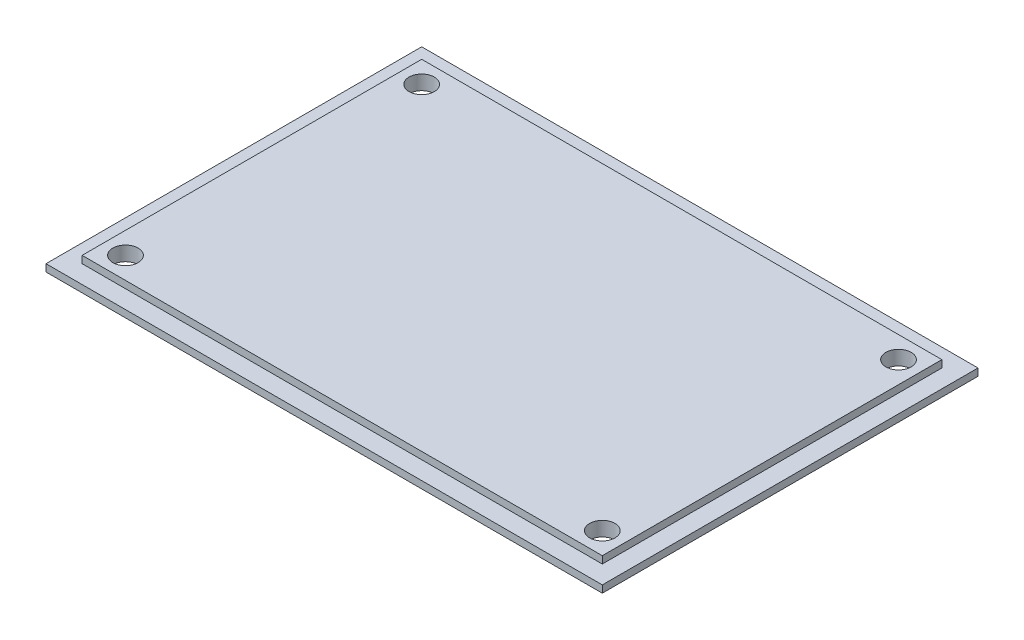
from build123d import *

# Parameters (mm, degrees)
SKETCH1_W           = 77
SKETCH1_H           = 52
BOSS_EXTRUDE1_DEPTH = 1
SKETCH2_W           = 72
SKETCH2_H           = 47
BOSS_EXTRUDE2_DEPTH = 1
SKETCH3_R           = 1.75
CUT_EXTRUDE1_DEPTH  = 11
CUT_EXTRUDE2_DEPTH  = 0.4


with BuildPart() as part:
    # Sketch1 → Boss-Extrude1 (new body)
    with BuildSketch(Plane(origin=(0, 0, 0), x_dir=(1, 0, 0), z_dir=(0, 1, 0))):
        Rectangle(SKETCH1_W, SKETCH1_H)
    extrude(amount=BOSS_EXTRUDE1_DEPTH)

    # Sketch2 → Boss-Extrude2 (add)
    with BuildSketch(Plane(origin=(0, 1, 0), x_dir=(1, 0, 0), z_dir=(0, 1, 0))):
        Rectangle(SKETCH2_W, SKETCH2_H)
    extrude(amount=BOSS_EXTRUDE2_DEPTH)

    # Sketch3 → Cut-Extrude1 (cut)
    with BuildSketch(Plane(origin=(0, 2, 0), x_dir=(1, 0, 0), z_dir=(0, 1, 0))):
        with Locations(Location((-33, 20.5, 0), (0, 0, 270))):
            Circle(SKETCH3_R)
        with Locations(Location((33, 20.5, 0), (0, 0, 270))):
            Circle(SKETCH3_R)
        with Locations(Location((33, -20.5, 0), (0, 0, 270))):
            Circle(SKETCH3_R)
        with Locations(Location((-33, -20.5, 0), (0, 0, 270))):
            Circle(SKETCH3_R)
    extrude(amount=-CUT_EXTRUDE1_DEPTH, mode=Mode.SUBTRACT)

    # Sketch4 → Cut-Extrude2 (cut)
    # profile 1 of 10: a face of its own
    with BuildSketch(Plane.XZ):
        with BuildLine():
            Line((-20.761007933, 11.297990355), (-21.613271555, 10.518232743))
            add(Edge.make_bspline(
                [(-21.613271555, 10.518232743), (-21.649778874, 10.569730112), (-21.719867836, 10.668597879), (-21.833474732, 10.800984149), (-21.946568635, 10.91391949), (-22.060197291, 11.006932109), (-22.17536786, 11.079456886), (-22.291880425, 11.130805229), (-22.409074442, 11.163447858), (-22.487810731, 11.167512651), (-22.526592869, 11.169514794)],
                knots=[0, 0, 0, 0, 1.299362458, 2.494594718, 3.587462134, 4.587049575, 5.512617175, 6.380583204, 7.202344345, 8, 8, 8, 8], degree=3))
            add(Edge.make_bspline(
                [(-22.526592869, 11.169514794), (-22.562767735, 11.168246144), (-22.632611897, 11.165796714), (-22.732179932, 11.141449565), (-22.820577852, 11.099429959), (-22.897719383, 11.044485791), (-22.958826857, 10.978290805), (-23.007616436, 10.908869286), (-23.035089069, 10.832243628), (-23.038705008, 10.779614036), (-23.040495113, 10.753559265)],
                knots=[0, 0, 0, 0, 1.185010067, 2.2879431, 3.333075148, 4.379039566, 5.372662701, 6.27520591, 7.14612461, 8, 8, 8, 8], degree=3))
            add(Edge.make_bspline(
                [(-23.040495113, 10.753559265), (-23.039373345, 10.727128774), (-23.037114261, 10.673901436), (-23.015294583, 10.595890145), (-22.982406099, 10.519664032), (-22.95097981, 10.473261569), (-22.934916186, 10.449542839)],
                knots=[0, 0, 0, 0, 0.967525499, 1.948461899, 2.951351359, 4, 4, 4, 4], degree=3))
            add(Edge.make_bspline(
                [(-22.934916186, 10.449542839), (-22.920312615, 10.431106518), (-22.886697122, 10.388668542), (-22.822599262, 10.321453404), (-22.742105811, 10.239108976), (-22.642119213, 10.144466842), (-22.526790185, 10.0341233), (-22.390773079, 9.912415998), (-22.237983059, 9.775575801), (-22.129383453, 9.680285244), (-22.072476282, 9.630352134)],
                knots=[0, 0, 0, 0, 0.473873513, 1.090794244, 1.870441696, 2.795289791, 3.865433203, 5.087734844, 6.473946851, 8, 8, 8, 8], degree=3))
            add(Edge.make_bspline(
                [(-22.072476282, 9.630352134), (-22.019060717, 9.584123656), (-21.91768907, 9.496391609), (-21.773457348, 9.371870055), (-21.646701685, 9.259841049), (-21.535575542, 9.161985907), (-21.441763482, 9.077277904), (-21.364871119, 9.005312137), (-21.303959343, 8.947489647), (-21.269334564, 8.912564828), (-21.254557613, 8.897659826)],
                knots=[0, 0, 0, 0, 1.543621617, 2.929473131, 4.163658386, 5.240097082, 6.164993805, 6.925417477, 7.541396219, 8, 8, 8, 8], degree=3))
            add(Edge.make_bspline(
                [(-21.254557613, 8.897659826), (-21.198496938, 8.83699017), (-21.090728634, 8.720361784), (-20.950667829, 8.539624465), (-20.835393256, 8.363187988), (-20.74621466, 8.187732415), (-20.678863398, 8.010726272), (-20.631379866, 7.827828492), (-20.602941663, 7.637127908), (-20.599784358, 7.50699804), (-20.59818742, 7.441179458)],
                knots=[0, 0, 0, 0, 1.206664779, 2.319633467, 3.337109185, 4.282041471, 5.190008762, 6.099243693, 7.03861361, 8, 8, 8, 8], degree=3))
            add(Edge.make_bspline(
                [(-20.59818742, 7.441179458), (-20.59932408, 7.377047322), (-20.601554248, 7.251217684), (-20.628869531, 7.067084752), (-20.667819521, 6.890861545), (-20.728043038, 6.72446562), (-20.801443105, 6.565165639), (-20.893460689, 6.415442988), (-21.001522724, 6.273782415), (-21.125378409, 6.142716274), (-21.262377504, 6.023782835), (-21.409322053, 5.917905479), (-21.567648954, 5.830490236), (-21.736005487, 5.758510018), (-21.914301536, 5.703069891), (-22.102324694, 5.662094471), (-22.300362558, 5.63750167), (-22.435783702, 5.634930784), (-22.50496827, 5.633617358)],
                knots=[0, 0, 0, 0, 1.043214005, 2.046824704, 3.02475056, 3.976699089, 4.921714032, 5.875962561, 6.831408892, 7.817874052, 8.806269674, 9.781291748, 10.760897367, 11.74438705, 12.757449933, 13.795994037, 14.874007457, 16, 16, 16, 16], degree=3))
            add(Edge.make_bspline(
                [(-22.50496827, 5.633617358), (-22.559277566, 5.634580841), (-22.666841119, 5.636489091), (-22.825373534, 5.652068356), (-22.978454502, 5.677211633), (-23.125911591, 5.71324946), (-23.268409121, 5.758914274), (-23.405952944, 5.814692095), (-23.537593549, 5.881447458), (-23.664326993, 5.957807609), (-23.785537193, 6.046471801), (-23.902756804, 6.145627326), (-24.014821492, 6.25679924), (-24.122269479, 6.379724625), (-24.224413284, 6.514751576), (-24.324596439, 6.659999594), (-24.418366503, 6.818164284), (-24.476292444, 6.929118093), (-24.505879728, 6.985790836)],
                knots=[0, 0, 0, 0, 1.016823716, 2.013894106, 2.979844003, 3.91962641, 4.853723003, 5.779685073, 6.695824784, 7.614987388, 8.547259901, 9.504950863, 10.487499108, 11.500346958, 12.559593716, 13.656357062, 14.802919212, 16, 16, 16, 16], degree=3))
            Line((-24.505879728, 6.985790836), (-23.503515946, 7.587463512))
            add(Edge.make_bspline(
                [(-23.503515946, 7.587463512), (-23.466506675, 7.523132544), (-23.39555674, 7.399804581), (-23.275325442, 7.234097831), (-23.152154616, 7.092197429), (-23.023196661, 6.976611474), (-22.890019659, 6.885794433), (-22.751980334, 6.820890275), (-22.608981702, 6.780714675), (-22.511577529, 6.775808306), (-22.462991106, 6.773360948)],
                knots=[0, 0, 0, 0, 1.283663364, 2.460892379, 3.537111102, 4.529833553, 5.449777664, 6.316464042, 7.160231139, 8, 8, 8, 8], degree=3))
            add(Edge.make_bspline(
                [(-22.462991106, 6.773360948), (-22.413571758, 6.775359594), (-22.317691024, 6.779237257), (-22.180833547, 6.815054064), (-22.055357429, 6.871289078), (-21.9468968, 6.951528689), (-21.855059178, 7.044137396), (-21.787277741, 7.147168816), (-21.744696985, 7.258646326), (-21.740195167, 7.336085937), (-21.73793101, 7.375033624)],
                knots=[0, 0, 0, 0, 1.13588714, 2.203786484, 3.234766741, 4.283437687, 5.291419208, 6.222934724, 7.106237994, 8, 8, 8, 8], degree=3))
            add(Edge.make_bspline(
                [(-21.73793101, 7.375033624), (-21.740021866, 7.411268109), (-21.74426924, 7.484874996), (-21.775554086, 7.594316601), (-21.824461842, 7.703708435), (-21.882323167, 7.793434576), (-21.94120431, 7.868559841), (-21.997507963, 7.933652486), (-22.066070919, 8.005568462), (-22.146719332, 8.084398236), (-22.238387626, 8.170835764), (-22.341153019, 8.264872584), (-22.456192284, 8.365680343), (-22.537502264, 8.434349592), (-22.58001835, 8.47025598)],
                knots=[0, 0, 0, 0, 0.916159276, 1.861089862, 2.860218735, 3.940849679, 4.552606315, 5.27541173, 6.11797699, 7.06649574, 8.129236253, 9.306560635, 10.591630461, 12, 12, 12, 12], degree=3))
            add(Edge.make_bspline(
                [(-22.58001835, 8.47025598), (-22.660843121, 8.538641487), (-22.81597032, 8.669893973), (-23.035184734, 8.863749763), (-23.23271655, 9.044925762), (-23.406859669, 9.215661701), (-23.559832946, 9.372804483), (-23.690600378, 9.517630481), (-23.797725426, 9.651256831), (-23.91045144, 9.8095283), (-24.017563692, 10.00239296), (-24.110139073, 10.234431504), (-24.170198073, 10.466440605), (-24.176926848, 10.622198737), (-24.180238702, 10.698861749)],
                knots=[0, 0, 0, 0, 1.345494975, 2.582412109, 3.71882943, 4.751509156, 5.681369928, 6.505683931, 7.230279997, 7.856715994, 8.973648664, 10.023341002, 11.027102913, 12, 12, 12, 12], degree=3))
            add(Edge.make_bspline(
                [(-24.180238702, 10.698861749), (-24.178861307, 10.753227043), (-24.176147689, 10.860332511), (-24.151941802, 11.017815496), (-24.115765183, 11.169773344), (-24.063226344, 11.315651644), (-23.995037276, 11.455267677), (-23.912224302, 11.589304923), (-23.813501492, 11.716529734), (-23.702247551, 11.836857767), (-23.579674192, 11.946823896), (-23.44868898, 12.043880023), (-23.310033305, 12.12585504), (-23.164555391, 12.193859268), (-23.011353772, 12.245912185), (-22.851557077, 12.282809888), (-22.684936107, 12.304755464), (-22.57160412, 12.307738711), (-22.513872516, 12.309258384)],
                knots=[0, 0, 0, 0, 1.010766082, 1.991317756, 2.957454644, 3.913069143, 4.869106762, 5.843196583, 6.838735724, 7.860187025, 8.887984031, 9.89767229, 10.887916223, 11.879572884, 12.879850636, 13.892031539, 14.926195476, 16, 16, 16, 16], degree=3))
            add(Edge.make_bspline(
                [(-22.513872516, 12.309258384), (-22.439055215, 12.306521408), (-22.290011194, 12.30106906), (-22.06964531, 12.258433482), (-21.854401128, 12.191384543), (-21.680953333, 12.110497376), (-21.542944159, 12.032141939), (-21.43717302, 11.960002123), (-21.329545192, 11.877362087), (-21.219192724, 11.783961409), (-21.108166136, 11.678040298), (-20.993308411, 11.562120291), (-20.876184626, 11.435199567), (-20.800072736, 11.34452799), (-20.761007933, 11.297990355)],
                knots=[0, 0, 0, 0, 1.282922637, 2.555718331, 3.837320111, 5.142675274, 5.830281639, 6.55870424, 7.337177975, 8.157850921, 9.037902056, 9.96903443, 10.957596896, 12, 12, 12, 12], degree=3))
        make_face()
    # profile 2 of 10: a face of its own
    with BuildSketch(Plane.XZ):
        with BuildLine():
            Line((-14.984695834, 7.831694281), (-18.644341266, 7.831694281))
            add(Edge.make_bspline(
                [(-18.644341266, 7.831694281), (-18.636879545, 7.789171278), (-18.622216673, 7.705610221), (-18.590375727, 7.584230534), (-18.549741903, 7.469844366), (-18.501044825, 7.362298811), (-18.445105524, 7.261025317), (-18.379856963, 7.166498896), (-18.306126762, 7.078803041), (-18.224341209, 6.998318887), (-18.13586352, 6.926203341), (-18.04112278, 6.863025564), (-17.940021221, 6.811223651), (-17.833717936, 6.767560014), (-17.721418594, 6.73297399), (-17.602957919, 6.709120667), (-17.478649931, 6.695030422), (-17.393967533, 6.692992429), (-17.350681411, 6.691950692)],
                knots=[0, 0, 0, 0, 1.091296461, 2.144483647, 3.168565212, 4.157007626, 5.126487748, 6.090021542, 7.05641414, 8.019231907, 8.98705074, 9.938580405, 10.892824166, 11.854447369, 12.841318655, 13.858982407, 14.905600794, 16, 16, 16, 16], degree=3))
            add(Edge.make_bspline(
                [(-17.350681411, 6.691950692), (-17.298432122, 6.693330123), (-17.195537887, 6.696046631), (-17.044797066, 6.720138015), (-16.899008734, 6.756526992), (-16.759552562, 6.810640456), (-16.62481317, 6.878002205), (-16.497008781, 6.961926656), (-16.373927202, 7.059961263), (-16.298832935, 7.1355263), (-16.260547196, 7.174052054)],
                knots=[0, 0, 0, 0, 1.021034703, 2.010718019, 2.977989445, 3.954245119, 4.929443971, 5.918328161, 6.938689359, 8, 8, 8, 8], degree=3))
            Line((-16.260547196, 7.174052054), (-15.306520754, 6.719935467))
            add(Edge.make_bspline(
                [(-15.306520754, 6.719935467), (-15.336557719, 6.678428991), (-15.396074862, 6.596185434), (-15.493234601, 6.480447508), (-15.594626975, 6.372459327), (-15.700327603, 6.272931148), (-15.810470539, 6.182146585), (-15.924749392, 6.098999718), (-16.044834302, 6.025723008), (-16.168324192, 5.958771371), (-16.297771827, 5.901374043), (-16.432818967, 5.852427628), (-16.572893613, 5.808180485), (-16.719764604, 5.774466587), (-16.872208948, 5.747778939), (-17.03059132, 5.728827174), (-17.194890847, 5.717121577), (-17.306564279, 5.715733893), (-17.363401763, 5.715027615)],
                knots=[0, 0, 0, 0, 1.028154879, 2.037251081, 3.030720504, 4.000128189, 4.949298328, 5.894184978, 6.834267904, 7.770992897, 8.712077017, 9.673380525, 10.653304757, 11.658697181, 12.695551717, 13.758623199, 14.859225354, 16, 16, 16, 16], degree=3))
            add(Edge.make_bspline(
                [(-17.363401763, 5.715027615), (-17.4508453, 5.716810325), (-17.622098427, 5.720301662), (-17.872587082, 5.752706257), (-18.110481829, 5.806436568), (-18.3364544, 5.879474674), (-18.54952799, 5.975907856), (-18.74980805, 6.093853636), (-18.939295664, 6.231050758), (-19.112200929, 6.390378626), (-19.269722726, 6.563797537), (-19.408080078, 6.750037606), (-19.52385554, 6.947797642), (-19.618932678, 7.15576883), (-19.692829933, 7.374483494), (-19.746105567, 7.604037076), (-19.778764169, 7.844319937), (-19.78229146, 8.007979388), (-19.784084856, 8.091189474)],
                knots=[0, 0, 0, 0, 1.103565453, 2.161269334, 3.182010356, 4.179077853, 5.15417608, 6.128274628, 7.109042802, 8.101804412, 9.090965879, 10.063106201, 11.02526161, 11.978650795, 12.945248442, 13.93468508, 14.949922959, 16, 16, 16, 16], degree=3))
            add(Edge.make_bspline(
                [(-19.784084856, 8.091189474), (-19.782273809, 8.176514035), (-19.778710656, 8.344386277), (-19.746386757, 8.590217379), (-19.692682644, 8.824773501), (-19.618569224, 9.04837765), (-19.524934417, 9.261729166), (-19.407685911, 9.462961477), (-19.269791385, 9.652775165), (-19.112837057, 9.830282263), (-18.939199313, 9.990501812), (-18.754692805, 10.133289449), (-18.557244413, 10.252269585), (-18.349087449, 10.348405462), (-18.13155336, 10.426513435), (-17.902127755, 10.478487768), (-17.662556214, 10.513385421), (-17.498790385, 10.516599277), (-17.415555209, 10.518232743)],
                knots=[0, 0, 0, 0, 1.079208495, 2.12329425, 3.130605359, 4.119693003, 5.099659317, 6.073216462, 7.060498243, 8.06384408, 9.066070512, 10.045757761, 11.010926815, 11.975797609, 12.942977511, 13.929384301, 14.947594487, 16, 16, 16, 16], degree=3))
            add(Edge.make_bspline(
                [(-17.415555209, 10.518232743), (-17.327692758, 10.516422375), (-17.155183892, 10.512867904), (-16.90295066, 10.480726427), (-16.66347632, 10.426668474), (-16.435740578, 10.354261915), (-16.222651712, 10.25539273), (-16.019527514, 10.140349408), (-15.831240054, 10.000186666), (-15.655782388, 9.841638498), (-15.497395985, 9.6657348), (-15.35894872, 9.474649509), (-15.241147137, 9.270247505), (-15.145667785, 9.051699893), (-15.071846409, 8.819662776), (-15.018521459, 8.5744375), (-14.986111964, 8.315091344), (-14.982650308, 8.137502167), (-14.980879728, 8.04666824)],
                knots=[0, 0, 0, 0, 1.080001299, 2.120471247, 3.119684163, 4.095710327, 5.052285597, 6.002875087, 6.961153713, 7.931888285, 8.906493152, 9.865905668, 10.82813294, 11.801621613, 12.7925306, 13.817193356, 14.883530496, 16, 16, 16, 16], degree=3))
            Line((-14.980879728, 8.04666824), (-14.984695834, 7.831694281))
        make_face()
        with BuildLine():
            add(Edge.make_bspline(
                [(-16.120623318, 8.727207102), (-16.142130976, 8.78524756), (-16.184893804, 8.900647111), (-16.281493253, 9.059870333), (-16.409677631, 9.19776411), (-16.558765259, 9.319842564), (-16.729107209, 9.418929063), (-16.915335708, 9.490670907), (-17.115096863, 9.533688216), (-17.252521773, 9.538733391), (-17.322696635, 9.541309666)],
                knots=[0, 0, 0, 0, 0.954238005, 1.897273737, 2.851915805, 3.847685534, 4.862635127, 5.880135777, 6.917509367, 8, 8, 8, 8], degree=3))
            add(Edge.make_bspline(
                [(-17.322696635, 9.541309666), (-17.399339009, 9.53883484), (-17.549158893, 9.53399707), (-17.765263874, 9.482545609), (-17.969110295, 9.40575584), (-18.089286592, 9.326583958), (-18.149519552, 9.286902615)],
                knots=[0, 0, 0, 0, 1.044195649, 2.041185066, 3.018232172, 4, 4, 4, 4], degree=3))
            add(Edge.make_bspline(
                [(-18.149519552, 9.286902615), (-18.18710042, 9.256680435), (-18.267220911, 9.192248293), (-18.371273623, 9.063712286), (-18.47376641, 8.908084036), (-18.53203921, 8.789873385), (-18.56293101, 8.727207102)],
                knots=[0, 0, 0, 0, 0.82159062, 1.751589201, 2.808063854, 4, 4, 4, 4], degree=3))
            Line((-18.56293101, 8.727207102), (-16.120623318, 8.727207102))
        make_face(mode=Mode.SUBTRACT)
    # profile 3 of 10: a face of its own
    with BuildSketch(Plane.XZ):
        with BuildLine():
            Line((-14.166777164, 10.436822487), (-13.189854087, 10.436822487))
            Line((-13.189854087, 10.436822487), (-13.189854087, 9.865678656))
            add(Edge.make_bspline(
                [(-13.189854087, 9.865678656), (-13.162218809, 9.916436366), (-13.10820451, 10.015644414), (-13.008975715, 10.148811573), (-12.894977655, 10.260961239), (-12.770306634, 10.354439124), (-12.634584799, 10.427295957), (-12.491446539, 10.479215635), (-12.342116398, 10.512956231), (-12.240248438, 10.516461241), (-12.18876234, 10.518232743)],
                knots=[0, 0, 0, 0, 1.09866127, 2.147379032, 3.14564304, 4.131443017, 5.102343063, 6.064490016, 7.021754664, 8, 8, 8, 8], degree=3))
            add(Edge.make_bspline(
                [(-12.18876234, 10.518232743), (-12.151377009, 10.516482129), (-12.075247124, 10.512917254), (-11.959214467, 10.49219458), (-11.841507663, 10.454724046), (-11.764046443, 10.42098681), (-11.724469472, 10.40374957)],
                knots=[0, 0, 0, 0, 0.931404136, 1.896671404, 2.925354185, 4, 4, 4, 4], degree=3))
            Line((-11.724469472, 10.40374957), (-12.078095273, 9.43827481))
            add(Edge.make_bspline(
                [(-12.078095273, 9.43827481), (-12.10970437, 9.453546798), (-12.169117304, 9.482252255), (-12.255374568, 9.516127651), (-12.333656612, 9.536796763), (-12.38328599, 9.539880775), (-12.406280369, 9.541309666)],
                knots=[0, 0, 0, 0, 1.214386998, 2.282580073, 3.20428172, 4, 4, 4, 4], degree=3))
            add(Edge.make_bspline(
                [(-12.406280369, 9.541309666), (-12.427991534, 9.540362808), (-12.470701136, 9.538500174), (-12.533739315, 9.522538037), (-12.593108152, 9.495011825), (-12.651668628, 9.459748017), (-12.704800972, 9.410728686), (-12.757900497, 9.353980107), (-12.804694642, 9.283916437), (-12.854076036, 9.205932015), (-12.896122527, 9.110479153), (-12.932176098, 8.996528105), (-12.96430012, 8.862760381), (-12.986405833, 8.708465739), (-13.007771891, 8.535137246), (-13.020489494, 8.341502692), (-13.029968085, 8.128174369), (-13.030547637, 7.979263501), (-13.03084968, 7.901656221)],
                knots=[0, 0, 0, 0, 0.544232178, 1.070598461, 1.618251235, 2.182094276, 2.777567932, 3.425210017, 4.127676488, 4.886675562, 5.738955394, 6.734782583, 7.883056018, 9.186093582, 10.642914445, 12.264202625, 14.053029461, 16, 16, 16, 16], degree=3))
            Line((-13.03084968, 7.901656221), (-13.027033574, 7.675233945))
            Line((-13.027033574, 7.675233945), (-13.027033574, 5.796437871))
            Line((-13.027033574, 5.796437871), (-14.166777164, 5.796437871))
            Line((-14.166777164, 5.796437871), (-14.166777164, 10.436822487))
        make_face()
    # profile 4 of 10: a face of its own
    with BuildSketch(Plane.XZ):
        Polygon((-11.683764343, 10.436822487), (-10.52366819, 10.436822487), (-9.322866907, 7.69813058), (-8.122065625, 10.436822487), (-6.961969472, 10.436822487), (-8.994681811, 5.796437871), (-9.651052004, 5.796437871), align=None)
    # profile 5 of 10: a face of its own
    with BuildSketch(Plane.XZ):
        with BuildLine():
            add(Edge.make_bspline(
                [(-4.059185016, 10.518232743), (-4.00530014, 10.517273825), (-3.898583668, 10.515374732), (-3.739642814, 10.49956652), (-3.583480613, 10.47377477), (-3.429199465, 10.440378957), (-3.278232014, 10.393586426), (-3.129786456, 10.337466022), (-2.982535497, 10.273033235), (-2.840133877, 10.19633568), (-2.701552852, 10.113150188), (-2.570169792, 10.021389765), (-2.447075744, 9.921775157), (-2.329985663, 9.816616009), (-2.224356135, 9.701334033), (-2.123436868, 9.581483999), (-2.032680284, 9.452772098), (-1.94865276, 9.318334741), (-1.87384366, 9.178949355), (-1.808885714, 9.035585552), (-1.752508325, 8.890225439), (-1.708365959, 8.74109843), (-1.671820149, 8.590170964), (-1.648757145, 8.435593536), (-1.632360948, 8.278954045), (-1.630522415, 8.17349145), (-1.629597677, 8.120446285)],
                knots=[0, 0, 0, 0, 1.022364134, 2.024744242, 3.027414945, 4.024939316, 5.017584196, 6.023349371, 7.035562955, 8.064994934, 9.090267829, 10.101425541, 11.102933353, 12.093946398, 13.084502048, 14.067315274, 15.065326281, 16.070028806, 17.074376865, 18.064572984, 19.055292013, 20.030201733, 21.013838017, 21.999348303, 22.993720005, 24, 24, 24, 24], degree=3))
            add(Edge.make_bspline(
                [(-1.629597677, 8.120446285), (-1.630573585, 8.066986704), (-1.632513911, 7.960696939), (-1.648163951, 7.80258406), (-1.674054423, 7.647279727), (-1.707578411, 7.493869014), (-1.754195831, 7.344314959), (-1.808663309, 7.196413076), (-1.875524282, 7.052179322), (-1.949444014, 6.910040244), (-2.034011799, 6.77417856), (-2.124689824, 6.644177277), (-2.225186391, 6.523446938), (-2.329970325, 6.408243359), (-2.444011764, 6.302462211), (-2.565490393, 6.204385889), (-2.693354546, 6.112815366), (-2.828523701, 6.02989906), (-2.969266566, 5.957043458), (-3.113209539, 5.891358188), (-3.261194319, 5.836670511), (-3.412914643, 5.792074216), (-3.568462525, 5.757544421), (-3.727494555, 5.73408792), (-3.889668236, 5.717774195), (-3.998934477, 5.715949035), (-4.054096875, 5.715027615)],
                knots=[0, 0, 0, 0, 1.012026251, 2.012137606, 3.004615893, 3.992048833, 4.982446996, 5.968083444, 6.973977695, 7.990229942, 8.999482246, 10.001782172, 10.988562221, 11.971415814, 12.948383116, 13.930088534, 14.925840678, 15.924049238, 16.929462851, 17.924729459, 18.917889337, 19.913673841, 20.916777188, 21.931792057, 22.95587778, 24, 24, 24, 24], degree=3))
            add(Edge.make_bspline(
                [(-4.054096875, 5.715027615), (-4.13475555, 5.717395106), (-4.293735025, 5.722061467), (-4.527874206, 5.75402482), (-4.752804668, 5.80904213), (-4.968892932, 5.885735047), (-5.176419703, 5.984014163), (-5.373573854, 6.105649492), (-5.56231653, 6.248246385), (-5.739378565, 6.4105996), (-5.901591376, 6.588715778), (-6.043303784, 6.778853713), (-6.163629085, 6.978163557), (-6.262459025, 7.18687259), (-6.338735585, 7.405267008), (-6.393820276, 7.632693889), (-6.425822708, 7.869792496), (-6.430449602, 8.030884129), (-6.432802805, 8.112814073)],
                knots=[0, 0, 0, 0, 1.029999031, 2.030143771, 3.011211297, 3.982305373, 4.953580601, 5.938004764, 6.935448627, 7.970290061, 9.001484052, 10.007591832, 10.993831261, 11.969999897, 12.951306496, 13.942897864, 14.953773953, 16, 16, 16, 16], degree=3))
            add(Edge.make_bspline(
                [(-6.432802805, 8.112814073), (-6.430367539, 8.200297293), (-6.425581073, 8.372243811), (-6.387574428, 8.624149377), (-6.326881914, 8.865337019), (-6.239761635, 9.095132057), (-6.12847314, 9.313958318), (-5.992615109, 9.521354274), (-5.831516124, 9.7173669), (-5.70814656, 9.835922056), (-5.645412981, 9.896207503)],
                knots=[0, 0, 0, 0, 1.043912699, 2.05178951, 3.033892, 4.007821512, 4.978932272, 5.95884105, 6.962068106, 8, 8, 8, 8], degree=3))
            add(Edge.make_bspline(
                [(-5.645412981, 9.896207503), (-5.587848652, 9.946177356), (-5.474286148, 10.044757534), (-5.289784454, 10.169790327), (-5.100875539, 10.277780515), (-4.905295248, 10.366568535), (-4.702498353, 10.433513269), (-4.493524075, 10.482243046), (-4.278415865, 10.512174303), (-4.132633334, 10.516203), (-4.059185016, 10.518232743)],
                knots=[0, 0, 0, 0, 1.048115528, 2.067714963, 3.060638214, 4.039924844, 5.017819947, 5.994373833, 6.98952318, 8, 8, 8, 8], degree=3))
        make_face()
        with BuildLine():
            add(Edge.make_bspline(
                [(-4.033744311, 9.45989941), (-4.077872055, 9.45843275), (-4.164737995, 9.455545614), (-4.29260694, 9.440051125), (-4.413546734, 9.408293841), (-4.529959468, 9.367907266), (-4.639785789, 9.313895913), (-4.746033449, 9.250690183), (-4.843177802, 9.171595989), (-4.935919975, 9.084835446), (-5.020109196, 8.98849019), (-5.091846407, 8.883522107), (-5.155945194, 8.773947053), (-5.204548054, 8.655753352), (-5.244771567, 8.532171578), (-5.271994358, 8.401205027), (-5.29093952, 8.264316667), (-5.292345929, 8.170547202), (-5.293059215, 8.122990355)],
                knots=[0, 0, 0, 0, 1.030650113, 2.02884584, 2.99876339, 3.944280128, 4.900564847, 5.851248946, 6.823638398, 7.81794922, 8.81432732, 9.802856497, 10.78262424, 11.771747962, 12.779760563, 13.812642396, 14.89064281, 16, 16, 16, 16], degree=3))
            add(Edge.make_bspline(
                [(-5.293059215, 8.122990355), (-5.292224574, 8.073756415), (-5.290593428, 7.977538133), (-5.273702569, 7.837046502), (-5.245848987, 7.703720876), (-5.206277776, 7.577767214), (-5.156510296, 7.458281435), (-5.095451369, 7.345933936), (-5.022456587, 7.241400219), (-4.939698221, 7.144809009), (-4.849081345, 7.057132099), (-4.749790456, 6.981891056), (-4.645983484, 6.916516575), (-4.535268151, 6.864010777), (-4.419216934, 6.823472041), (-4.297485323, 6.793624733), (-4.16943362, 6.777544451), (-4.082122595, 6.774774624), (-4.037560417, 6.773360948)],
                knots=[0, 0, 0, 0, 1.141730614, 2.231293227, 3.276944405, 4.297399982, 5.28939179, 6.275415646, 7.257752684, 8.24146775, 9.222424823, 10.176631434, 11.126518621, 12.063689483, 13.012557477, 13.974037417, 14.965980454, 16, 16, 16, 16], degree=3))
            add(Edge.make_bspline(
                [(-4.037560417, 6.773360948), (-3.992975951, 6.774614815), (-3.905564515, 6.777073122), (-3.777362439, 6.795481958), (-3.655009178, 6.824453839), (-3.537966792, 6.865341478), (-3.427181581, 6.918971134), (-3.322229449, 6.984658375), (-3.222187119, 7.060945954), (-3.130354155, 7.15027716), (-3.045346137, 7.247169603), (-2.97079919, 7.352255146), (-2.908504949, 7.464602674), (-2.857412518, 7.583505294), (-2.817763733, 7.708799577), (-2.790371272, 7.840951224), (-2.771415982, 7.979550689), (-2.770041379, 8.074586639), (-2.769341266, 8.122990355)],
                knots=[0, 0, 0, 0, 1.031504075, 2.022346795, 2.991027682, 3.937587355, 4.885570121, 5.833146507, 6.798790848, 7.791235734, 8.792807298, 9.778388351, 10.766749885, 11.760164525, 12.768777521, 13.802286646, 14.880660483, 16, 16, 16, 16], degree=3))
            add(Edge.make_bspline(
                [(-2.769341266, 8.122990355), (-2.770186525, 8.171377154), (-2.771845198, 8.266327751), (-2.78873726, 8.405114669), (-2.816317495, 8.536839166), (-2.856399088, 8.660938787), (-2.905870757, 8.778829314), (-2.966971887, 8.889907308), (-3.040326656, 8.993625683), (-3.123487334, 9.089470144), (-3.215462613, 9.175916748), (-3.313029573, 9.253006133), (-3.418419268, 9.316764976), (-3.529654526, 9.369325024), (-3.647031289, 9.409762478), (-3.770417783, 9.439778938), (-3.90019215, 9.455630405), (-3.988761664, 9.458461536), (-4.033744311, 9.45989941)],
                knots=[0, 0, 0, 0, 1.123894411, 2.205445421, 3.243160173, 4.246488011, 5.231014757, 6.210004299, 7.185865357, 8.177612767, 9.153374344, 10.115157457, 11.061423229, 12.009021698, 12.96873347, 13.94135618, 14.954456845, 16, 16, 16, 16], degree=3))
        make_face(mode=Mode.SUBTRACT)
    # profile 6 of 10: a face of its own
    with BuildSketch(Plane.XZ):
        with BuildLine():
            Line((1.952453605, 5.796437871), (1.952453605, 12.146437871))
            Line((1.952453605, 12.146437871), (2.97008181, 12.146437871))
            add(Edge.make_bspline(
                [(2.97008181, 12.146437871), (3.041322148, 12.146446001), (3.17917085, 12.146461733), (3.378050552, 12.139477731), (3.562494679, 12.130443142), (3.73191626, 12.120335538), (3.886603661, 12.102918116), (4.026321655, 12.084562056), (4.151349399, 12.062425778), (4.228647259, 12.042568852), (4.265013702, 12.033226733)],
                knots=[0, 0, 0, 0, 1.311965854, 2.538629056, 3.664479157, 4.713267157, 5.663616078, 6.530575999, 7.308677837, 8, 8, 8, 8], degree=3))
            add(Edge.make_bspline(
                [(4.265013702, 12.033226733), (4.312766533, 12.020049509), (4.406472919, 11.994191563), (4.540690367, 11.941970326), (4.668014339, 11.883922717), (4.788289376, 11.817701253), (4.90077694, 11.742506454), (5.005049542, 11.657741551), (5.103356082, 11.566809005), (5.192205921, 11.467174551), (5.272511536, 11.361892294), (5.342282717, 11.25098982), (5.402904931, 11.136162902), (5.451418581, 11.015966519), (5.487972705, 10.890954207), (5.514708239, 10.761659789), (5.532036485, 10.627674144), (5.533673777, 10.536519331), (5.534504887, 10.490247967)],
                knots=[0, 0, 0, 0, 1.099996261, 2.158545794, 3.195537121, 4.207578794, 5.205712374, 6.197378256, 7.190519799, 8.17788031, 9.159561366, 10.129234751, 11.085776129, 12.040971148, 13.00380137, 13.975669004, 14.972423361, 16, 16, 16, 16], degree=3))
            add(Edge.make_bspline(
                [(5.534504887, 10.490247967), (5.53233178, 10.43080141), (5.528054285, 10.313788166), (5.500729357, 10.141916881), (5.449490859, 9.979473813), (5.38244653, 9.823465197), (5.291287204, 9.674472948), (5.17553249, 9.532567905), (5.037057235, 9.393380602), (4.930839071, 9.309947202), (4.875590625, 9.266550051)],
                knots=[0, 0, 0, 0, 0.986156485, 1.941127874, 2.875419072, 3.804401753, 4.751181392, 5.761612777, 6.835722519, 8, 8, 8, 8], degree=3))
            add(Edge.make_bspline(
                [(4.875590625, 9.266550051), (4.920361315, 9.243695001), (5.008144253, 9.198882573), (5.132770235, 9.125224318), (5.248160291, 9.046879422), (5.354831794, 8.965424215), (5.450547188, 8.877405695), (5.539258721, 8.787895608), (5.616589827, 8.691765398), (5.685741634, 8.592441331), (5.74584726, 8.488485181), (5.798192632, 8.380072507), (5.84240689, 8.266832948), (5.879848668, 8.149342801), (5.907772755, 8.027197955), (5.925979854, 7.900354727), (5.939920347, 7.769245716), (5.941004787, 7.679937532), (5.941556169, 7.634528817)],
                knots=[0, 0, 0, 0, 1.164658916, 2.283573913, 3.35186032, 4.395461096, 5.390182219, 6.362969632, 7.312859996, 8.245001507, 9.165155236, 10.092416118, 11.032087915, 11.979892451, 12.947605196, 13.931445124, 14.948243989, 16, 16, 16, 16], degree=3))
            add(Edge.make_bspline(
                [(5.941556169, 7.634528817), (5.937978064, 7.547800767), (5.930916686, 7.376643308), (5.879287338, 7.125344849), (5.789778454, 6.887091118), (5.669586481, 6.662829036), (5.521486844, 6.459050622), (5.351214732, 6.280542501), (5.160484394, 6.129439339), (4.984512605, 6.027456427), (4.832310865, 5.959016357), (4.706245008, 5.916702389), (4.570852949, 5.877502794), (4.423654631, 5.849976028), (4.26731856, 5.824780506), (4.100320449, 5.809224268), (3.922972413, 5.798682189), (3.801162116, 5.797201102), (3.738391105, 5.796437871)],
                knots=[0, 0, 0, 0, 1.284142165, 2.534249414, 3.780121997, 5.041676246, 6.291546858, 7.49970053, 8.684500223, 9.883330709, 10.50184324, 11.153274765, 11.851151195, 12.587658647, 13.369265475, 14.195992086, 15.070362669, 16, 16, 16, 16], degree=3))
            Line((3.738391105, 5.796437871), (1.952453605, 5.796437871))
        make_face()
        with BuildLine():
            Line((3.092197195, 11.006694281), (3.092197195, 9.622719922))
            Line((3.092197195, 9.622719922), (3.394941586, 9.622719922))
            add(Edge.make_bspline(
                [(3.394941586, 9.622719922), (3.436087269, 9.623078728), (3.515516519, 9.623771382), (3.630243646, 9.632692513), (3.736921347, 9.647912518), (3.835145015, 9.669148253), (3.92582964, 9.696114541), (4.008395903, 9.728560792), (4.082480774, 9.768148746), (4.16855026, 9.82711675), (4.259531913, 9.913890807), (4.339622039, 10.039253912), (4.386794588, 10.183421006), (4.392048338, 10.285098803), (4.394761298, 10.337603737)],
                knots=[0, 0, 0, 0, 1.065314748, 2.056525647, 2.977365736, 3.853934255, 4.656397591, 5.425096493, 6.14721249, 6.826394842, 8.123232004, 9.372140726, 10.643011755, 12, 12, 12, 12], degree=3))
            add(Edge.make_bspline(
                [(4.394761298, 10.337603737), (4.392590433, 10.38678333), (4.388393154, 10.481870098), (4.340896462, 10.615380389), (4.267124709, 10.733697831), (4.180026786, 10.814676444), (4.098007167, 10.869982449), (4.027776936, 10.906399099), (3.950693983, 10.938998911), (3.865266067, 10.963925522), (3.771981026, 10.982629573), (3.671291998, 10.996365459), (3.56302526, 11.005714687), (3.488245194, 11.006360746), (3.449639102, 11.006694281)],
                knots=[0, 0, 0, 0, 1.347982417, 2.606269829, 3.849316587, 5.153353503, 5.842674298, 6.568177932, 7.326619318, 8.142485038, 9.012069166, 9.942760135, 10.937925643, 12, 12, 12, 12], degree=3))
            Line((3.449639102, 11.006694281), (3.092197195, 11.006694281))
        make_face(mode=Mode.SUBTRACT)
        with BuildLine():
            Line((3.092197195, 8.564386589), (3.092197195, 6.936181461))
            Line((3.092197195, 6.936181461), (3.420382291, 6.936181461))
            add(Edge.make_bspline(
                [(3.420382291, 6.936181461), (3.485264903, 6.936552133), (3.610009819, 6.937264796), (3.788706691, 6.945875461), (3.951186822, 6.961394667), (4.097019701, 6.980769145), (4.226428699, 7.007018533), (4.338976381, 7.040391266), (4.436206194, 7.077107084), (4.517535143, 7.12245548), (4.583976235, 7.175229766), (4.643932355, 7.229166355), (4.692816839, 7.291387306), (4.731495155, 7.359221645), (4.764971169, 7.43098432), (4.785161537, 7.509477637), (4.800533774, 7.592375242), (4.80137975, 7.649713723), (4.80181258, 7.679050051)],
                knots=[0, 0, 0, 0, 1.753078804, 3.370512758, 4.83203934, 6.162291463, 7.344201807, 8.395507345, 9.331626367, 10.147333109, 10.898971645, 11.62040215, 12.321813352, 13.025280112, 13.727906689, 14.453419512, 15.208716525, 16, 16, 16, 16], degree=3))
            add(Edge.make_bspline(
                [(4.80181258, 7.679050051), (4.800858065, 7.712596603), (4.798998929, 7.777936262), (4.783815335, 7.873437148), (4.756221785, 7.962593561), (4.721466362, 8.047685351), (4.673102345, 8.125665936), (4.615623363, 8.199233929), (4.54617408, 8.265898089), (4.46807431, 8.329690515), (4.37697866, 8.38554424), (4.272844391, 8.43400724), (4.155105789, 8.474481752), (4.023398146, 8.506707586), (3.878298859, 8.534057205), (3.718748862, 8.550387947), (3.546076943, 8.562533838), (3.426343423, 8.563754972), (3.36441274, 8.564386589)],
                knots=[0, 0, 0, 0, 0.845221588, 1.646264278, 2.427170338, 3.19324141, 3.95557735, 4.731569926, 5.540061037, 6.376114724, 7.268642756, 8.224665384, 9.265483498, 10.400594375, 11.639216012, 12.983232105, 14.439614077, 16, 16, 16, 16], degree=3))
            Line((3.36441274, 8.564386589), (3.092197195, 8.564386589))
        make_face(mode=Mode.SUBTRACT)
    # profile 7 of 10: a face of its own
    with BuildSketch(Plane.XZ):
        with BuildLine():
            add(Edge.make_bspline(
                [(9.129276522, 10.518232743), (9.183161399, 10.517273825), (9.289877871, 10.515374732), (9.448818724, 10.49956652), (9.604980926, 10.47377477), (9.759262074, 10.440378957), (9.910229524, 10.393586426), (10.058675083, 10.337466022), (10.205926042, 10.273033235), (10.348327661, 10.19633568), (10.486908687, 10.113150188), (10.618291746, 10.021389765), (10.741385795, 9.921775157), (10.858475876, 9.816616009), (10.964105403, 9.701334033), (11.06502467, 9.581483999), (11.155781255, 9.452772098), (11.239808779, 9.318334741), (11.314617879, 9.178949355), (11.379575824, 9.035585552), (11.435953213, 8.890225439), (11.480095579, 8.74109843), (11.51664139, 8.590170964), (11.539704394, 8.435593536), (11.55610059, 8.278954045), (11.557939123, 8.17349145), (11.558863862, 8.120446285)],
                knots=[0, 0, 0, 0, 1.022364134, 2.024744242, 3.027414945, 4.024939316, 5.017584196, 6.023349371, 7.035562955, 8.064994934, 9.090267829, 10.101425541, 11.102933353, 12.093946398, 13.084502048, 14.067315274, 15.065326281, 16.070028806, 17.074376865, 18.064572984, 19.055292013, 20.030201733, 21.013838017, 21.999348303, 22.993720005, 24, 24, 24, 24], degree=3))
            add(Edge.make_bspline(
                [(11.558863862, 8.120446285), (11.557887954, 8.066986704), (11.555947627, 7.960696939), (11.540297588, 7.80258406), (11.514407115, 7.647279727), (11.480883127, 7.493869014), (11.434265708, 7.344314959), (11.379798229, 7.196413076), (11.312937257, 7.052179322), (11.239017525, 6.910040244), (11.154449739, 6.77417856), (11.063771715, 6.644177277), (10.963275147, 6.523446938), (10.858491214, 6.408243359), (10.744449775, 6.302462211), (10.622971145, 6.204385889), (10.495106992, 6.112815366), (10.359937838, 6.02989906), (10.219194972, 5.957043458), (10.075251999, 5.891358188), (9.92726722, 5.836670511), (9.775546895, 5.792074216), (9.619999013, 5.757544421), (9.460966984, 5.73408792), (9.298793302, 5.717774195), (9.189527061, 5.715949035), (9.134364663, 5.715027615)],
                knots=[0, 0, 0, 0, 1.012026251, 2.012137606, 3.004615893, 3.992048833, 4.982446996, 5.968083444, 6.973977695, 7.990229942, 8.999482246, 10.001782172, 10.988562221, 11.971415814, 12.948383116, 13.930088534, 14.925840678, 15.924049238, 16.929462851, 17.924729459, 18.917889337, 19.913673841, 20.916777188, 21.931792057, 22.95587778, 24, 24, 24, 24], degree=3))
            add(Edge.make_bspline(
                [(9.134364663, 5.715027615), (9.053705989, 5.717395106), (8.894726513, 5.722061467), (8.660587333, 5.75402482), (8.435656871, 5.80904213), (8.219568606, 5.885735047), (8.012041835, 5.984014163), (7.814887685, 6.105649492), (7.626145009, 6.248246385), (7.449082973, 6.4105996), (7.286870162, 6.588715778), (7.145157755, 6.778853713), (7.024832453, 6.978163557), (6.926002513, 7.18687259), (6.849725953, 7.405267008), (6.794641262, 7.632693889), (6.762638831, 7.869792496), (6.758011936, 8.030884129), (6.755658734, 8.112814073)],
                knots=[0, 0, 0, 0, 1.029999031, 2.030143771, 3.011211297, 3.982305373, 4.953580601, 5.938004764, 6.935448627, 7.970290061, 9.001484052, 10.007591832, 10.993831261, 11.969999897, 12.951306496, 13.942897864, 14.953773953, 16, 16, 16, 16], degree=3))
            add(Edge.make_bspline(
                [(6.755658734, 8.112814073), (6.758093999, 8.200297293), (6.762880465, 8.372243811), (6.800887111, 8.624149377), (6.861579624, 8.865337019), (6.948699904, 9.095132057), (7.059988398, 9.313958318), (7.195846429, 9.521354274), (7.356945415, 9.7173669), (7.480314979, 9.835922056), (7.543048557, 9.896207503)],
                knots=[0, 0, 0, 0, 1.043912699, 2.05178951, 3.033892, 4.007821512, 4.978932272, 5.95884105, 6.962068106, 8, 8, 8, 8], degree=3))
            add(Edge.make_bspline(
                [(7.543048557, 9.896207503), (7.600612886, 9.946177356), (7.714175391, 10.044757534), (7.898677085, 10.169790327), (8.087586, 10.277780515), (8.283166291, 10.366568535), (8.485963185, 10.433513269), (8.694937464, 10.482243046), (8.910045673, 10.512174303), (9.055828204, 10.516203), (9.129276522, 10.518232743)],
                knots=[0, 0, 0, 0, 1.048115528, 2.067714963, 3.060638214, 4.039924844, 5.017819947, 5.994373833, 6.98952318, 8, 8, 8, 8], degree=3))
        make_face()
        with BuildLine():
            add(Edge.make_bspline(
                [(9.154717227, 9.45989941), (9.110589483, 9.45843275), (9.023723544, 9.455545614), (8.895854599, 9.440051125), (8.774914804, 9.408293841), (8.65850207, 9.367907266), (8.548675749, 9.313895913), (8.44242809, 9.250690183), (8.345283736, 9.171595989), (8.252541563, 9.084835446), (8.168352342, 8.98849019), (8.096615131, 8.883522107), (8.032516344, 8.773947053), (7.983913484, 8.655753352), (7.943689972, 8.532171578), (7.916467181, 8.401205027), (7.897522019, 8.264316667), (7.896115609, 8.170547202), (7.895402323, 8.122990355)],
                knots=[0, 0, 0, 0, 1.030650113, 2.02884584, 2.99876339, 3.944280128, 4.900564847, 5.851248946, 6.823638398, 7.81794922, 8.81432732, 9.802856497, 10.78262424, 11.771747962, 12.779760563, 13.812642396, 14.89064281, 16, 16, 16, 16], degree=3))
            add(Edge.make_bspline(
                [(7.895402323, 8.122990355), (7.896236965, 8.073756415), (7.897868111, 7.977538133), (7.914758969, 7.837046502), (7.942612551, 7.703720876), (7.982183763, 7.577767214), (8.031951243, 7.458281435), (8.09301017, 7.345933936), (8.166004952, 7.241400219), (8.248763318, 7.144809009), (8.339380194, 7.057132099), (8.438671082, 6.981891056), (8.542478055, 6.916516575), (8.653193387, 6.864010777), (8.769244605, 6.823472041), (8.890976215, 6.793624733), (9.019027918, 6.777544451), (9.106338943, 6.774774624), (9.150901121, 6.773360948)],
                knots=[0, 0, 0, 0, 1.141730614, 2.231293227, 3.276944405, 4.297399982, 5.28939179, 6.275415646, 7.257752684, 8.24146775, 9.222424823, 10.176631434, 11.126518621, 12.063689483, 13.012557477, 13.974037417, 14.965980454, 16, 16, 16, 16], degree=3))
            add(Edge.make_bspline(
                [(9.150901121, 6.773360948), (9.195485588, 6.774614815), (9.282897023, 6.777073122), (9.411099099, 6.795481958), (9.533452361, 6.824453839), (9.650494746, 6.865341478), (9.761279957, 6.918971134), (9.86623209, 6.984658375), (9.96627442, 7.060945954), (10.058107383, 7.15027716), (10.143115401, 7.247169603), (10.217662348, 7.352255146), (10.279956589, 7.464602674), (10.331049021, 7.583505294), (10.370697805, 7.708799577), (10.398090266, 7.840951224), (10.417045557, 7.979550689), (10.418420159, 8.074586639), (10.419120272, 8.122990355)],
                knots=[0, 0, 0, 0, 1.031504075, 2.022346795, 2.991027682, 3.937587355, 4.885570121, 5.833146507, 6.798790848, 7.791235734, 8.792807298, 9.778388351, 10.766749885, 11.760164525, 12.768777521, 13.802286646, 14.880660483, 16, 16, 16, 16], degree=3))
            add(Edge.make_bspline(
                [(10.419120272, 8.122990355), (10.418275013, 8.171377154), (10.416616341, 8.266327751), (10.399724279, 8.405114669), (10.372144044, 8.536839166), (10.332062451, 8.660938787), (10.282590782, 8.778829314), (10.221489651, 8.889907308), (10.148134882, 8.993625683), (10.064974205, 9.089470144), (9.972998925, 9.175916748), (9.875431966, 9.253006133), (9.77004227, 9.316764976), (9.658807013, 9.369325024), (9.54143025, 9.409762478), (9.418043755, 9.439778938), (9.288269388, 9.455630405), (9.199699875, 9.458461536), (9.154717227, 9.45989941)],
                knots=[0, 0, 0, 0, 1.123894411, 2.205445421, 3.243160173, 4.246488011, 5.231014757, 6.210004299, 7.185865357, 8.177612767, 9.153374344, 10.115157457, 11.061423229, 12.009021698, 12.96873347, 13.94135618, 14.954456845, 16, 16, 16, 16], degree=3))
        make_face(mode=Mode.SUBTRACT)
    # profile 8 of 10: a face of its own
    with BuildSketch(Plane.XZ):
        with BuildLine():
            Line((16.036427964, 10.436822487), (17.176171554, 10.436822487))
            Line((17.176171554, 10.436822487), (17.176171554, 5.796437871))
            Line((17.176171554, 5.796437871), (16.036427964, 5.796437871))
            Line((16.036427964, 5.796437871), (16.036427964, 6.302707903))
            add(Edge.make_bspline(
                [(16.036427964, 6.302707903), (15.979954089, 6.253428119), (15.870349451, 6.157785789), (15.697648006, 6.033687435), (15.524441908, 5.931322331), (15.349898896, 5.849794108), (15.171336317, 5.789593907), (14.987468593, 5.746007555), (14.795647833, 5.720303617), (14.665250723, 5.716804601), (14.599028125, 5.715027615)],
                knots=[0, 0, 0, 0, 1.129196829, 2.191548051, 3.199897424, 4.157751732, 5.089409408, 6.034969131, 7.002052659, 8, 8, 8, 8], degree=3))
            add(Edge.make_bspline(
                [(14.599028125, 5.715027615), (14.524690314, 5.716699983), (14.377794589, 5.720004677), (14.162241419, 5.754791918), (13.954103404, 5.808041543), (13.753549494, 5.883396418), (13.560944578, 5.981041563), (13.374814646, 6.09842928), (13.19835053, 6.23968058), (13.030083228, 6.398683879), (12.876018696, 6.573588639), (12.741334027, 6.761967207), (12.627804862, 6.961147847), (12.534796491, 7.170470185), (12.461633397, 7.389780589), (12.40947858, 7.619774647), (12.378707177, 7.860534499), (12.374898545, 8.024530681), (12.372966426, 8.107725932)],
                knots=[0, 0, 0, 0, 0.980476535, 1.937477201, 2.874147792, 3.812856188, 4.758993464, 5.720109578, 6.712210464, 7.737600662, 8.772720504, 9.783789959, 10.789002326, 11.793715968, 12.802552247, 13.835794126, 14.902098527, 16, 16, 16, 16], degree=3))
            add(Edge.make_bspline(
                [(12.372966426, 8.107725932), (12.374994192, 8.193874724), (12.378971881, 8.362865177), (12.40806844, 8.610850633), (12.459260804, 8.846547374), (12.529065273, 9.070281874), (12.618856601, 9.282092787), (12.728216439, 9.482327125), (12.858632525, 9.67046151), (13.008913946, 9.84329376), (13.171180968, 10.001702866), (13.344777996, 10.139610554), (13.526990352, 10.256769553), (13.718011667, 10.352416761), (13.917814664, 10.426328083), (14.125610522, 10.480363295), (14.34232171, 10.51278632), (14.489947127, 10.516402192), (14.564683173, 10.518232743)],
                knots=[0, 0, 0, 0, 1.136281865, 2.228943489, 3.287578264, 4.313574083, 5.316051562, 6.317280042, 7.318008486, 8.329309503, 9.333984563, 10.305318864, 11.248632312, 12.186624717, 13.117503092, 14.05354244, 15.014596925, 16, 16, 16, 16], degree=3))
            add(Edge.make_bspline(
                [(14.564683173, 10.518232743), (14.633912967, 10.51679448), (14.770893775, 10.513948675), (14.972235826, 10.483048679), (15.167508577, 10.43631463), (15.355646804, 10.369727022), (15.538193679, 10.28564662), (15.712009282, 10.18028761), (15.880895985, 10.058078183), (15.983943428, 9.962630031), (16.036427964, 9.914015996)],
                knots=[0, 0, 0, 0, 1.017011718, 2.012299608, 2.98747302, 3.965332399, 4.941441765, 5.936729654, 6.94912688, 8, 8, 8, 8], degree=3))
            Line((16.036427964, 9.914015996), (16.036427964, 10.436822487))
        make_face()
        with BuildLine():
            add(Edge.make_bspline(
                [(14.803825801, 9.45989941), (14.758410379, 9.458505908), (14.669399116, 9.455774735), (14.538495874, 9.43934654), (14.413391643, 9.410399329), (14.294978658, 9.36763604), (14.18149213, 9.315544124), (14.07465537, 9.250299857), (13.973586621, 9.173182519), (13.87888028, 9.086059121), (13.792541496, 8.990294577), (13.718112425, 8.885794711), (13.654859739, 8.7753752), (13.601364406, 8.658704052), (13.563073885, 8.534400684), (13.532747808, 8.404083308), (13.517010537, 8.266687295), (13.514157866, 8.173056164), (13.512710016, 8.125534426)],
                knots=[0, 0, 0, 0, 1.04836806, 2.054732945, 3.03993516, 4.00574415, 4.955904794, 5.917688631, 6.888591924, 7.88601754, 8.884115178, 9.859153345, 10.841239365, 11.818093293, 12.814750328, 13.83810466, 14.90274714, 16, 16, 16, 16], degree=3))
            add(Edge.make_bspline(
                [(13.512710016, 8.125534426), (13.51413575, 8.077581637), (13.516945143, 7.983091224), (13.533002264, 7.844536226), (13.562237084, 7.712315219), (13.604889583, 7.587497118), (13.656978179, 7.468397715), (13.720381714, 7.355566664), (13.798261851, 7.25099896), (13.88467632, 7.15222018), (13.981325547, 7.064014562), (14.082966184, 6.985696073), (14.190986561, 6.920167042), (14.304214733, 6.867206066), (14.42226957, 6.824047321), (14.546631122, 6.795463917), (14.676081109, 6.777191088), (14.764330584, 6.774646477), (14.808913942, 6.773360948)],
                knots=[0, 0, 0, 0, 1.099136573, 2.165835871, 3.191374663, 4.196217796, 5.183857741, 6.167377911, 7.154730987, 8.166690795, 9.170734848, 10.148332609, 11.103258353, 12.059567475, 13.009337315, 13.978056681, 14.978520572, 16, 16, 16, 16], degree=3))
            add(Edge.make_bspline(
                [(14.808913942, 6.773360948), (14.85517528, 6.774762262), (14.94587265, 6.7775096), (15.078911513, 6.79378787), (15.205696342, 6.822841219), (15.325699644, 6.865849337), (15.440754356, 6.917567336), (15.549822213, 6.98153668), (15.651719663, 7.058477055), (15.74696277, 7.146388051), (15.834234718, 7.24293457), (15.909693084, 7.348804786), (15.975420081, 7.460612678), (16.027111341, 7.581001794), (16.06816145, 7.707865885), (16.097613956, 7.841992298), (16.113634412, 7.983525635), (16.116419234, 8.080127653), (16.117838221, 8.129350531)],
                knots=[0, 0, 0, 0, 1.050008698, 2.058587853, 3.036635738, 3.995319155, 4.947022481, 5.895997462, 6.858296291, 7.838991643, 8.833936038, 9.806048392, 10.784806122, 11.771666913, 12.772873988, 13.80724452, 14.882696879, 16, 16, 16, 16], degree=3))
            add(Edge.make_bspline(
                [(16.117838221, 8.129350531), (16.116436866, 8.1777268), (16.113699614, 8.272219704), (16.097544864, 8.410797892), (16.067883262, 8.542290674), (16.027678032, 8.666939751), (15.975067169, 8.784460113), (15.90929044, 8.89354874), (15.834659809, 8.997985144), (15.746421635, 9.091923407), (15.651694481, 9.17919786), (15.548298464, 9.253811501), (15.439491119, 9.318115608), (15.324603933, 9.37091176), (15.202573102, 9.40961334), (15.075571606, 9.439578558), (14.941617959, 9.455764875), (14.850506057, 9.458498741), (14.803825801, 9.45989941)],
                knots=[0, 0, 0, 0, 1.106611376, 2.161533483, 3.185006901, 4.184773755, 5.152708835, 6.122342771, 7.094156588, 8.082475533, 9.064254463, 10.03606828, 10.992420271, 11.951521816, 12.920622147, 13.915721683, 14.932141191, 16, 16, 16, 16], degree=3))
        make_face(mode=Mode.SUBTRACT)
    # profile 9 of 10: a face of its own
    with BuildSketch(Plane.XZ):
        with BuildLine():
            Line((18.153094631, 10.436822487), (19.130017708, 10.436822487))
            Line((19.130017708, 10.436822487), (19.130017708, 9.865678656))
            add(Edge.make_bspline(
                [(19.130017708, 9.865678656), (19.157652986, 9.916436366), (19.211667284, 10.015644414), (19.31089608, 10.148811573), (19.42489414, 10.260961239), (19.54956516, 10.354439124), (19.685286996, 10.427295957), (19.828425256, 10.479215635), (19.977755397, 10.512956231), (20.079623357, 10.516461241), (20.131109455, 10.518232743)],
                knots=[0, 0, 0, 0, 1.09866127, 2.147379032, 3.14564304, 4.131443017, 5.102343063, 6.064490016, 7.021754664, 8, 8, 8, 8], degree=3))
            add(Edge.make_bspline(
                [(20.131109455, 10.518232743), (20.168494786, 10.516482129), (20.244624671, 10.512917254), (20.360657327, 10.49219458), (20.478364132, 10.454724046), (20.555825352, 10.42098681), (20.595402323, 10.40374957)],
                knots=[0, 0, 0, 0, 0.931404136, 1.896671404, 2.925354185, 4, 4, 4, 4], degree=3))
            Line((20.595402323, 10.40374957), (20.241776522, 9.43827481))
            add(Edge.make_bspline(
                [(20.241776522, 9.43827481), (20.210167425, 9.453546798), (20.150754491, 9.482252255), (20.064497227, 9.516127651), (19.986215183, 9.536796763), (19.936585804, 9.539880775), (19.913591426, 9.541309666)],
                knots=[0, 0, 0, 0, 1.214386998, 2.282580073, 3.20428172, 4, 4, 4, 4], degree=3))
            add(Edge.make_bspline(
                [(19.913591426, 9.541309666), (19.891880261, 9.540362808), (19.849170658, 9.538500174), (19.78613248, 9.522538037), (19.726763643, 9.495011825), (19.668203167, 9.459748017), (19.615070823, 9.410728686), (19.561971298, 9.353980107), (19.515177153, 9.283916437), (19.465795759, 9.205932015), (19.423749268, 9.110479153), (19.387695696, 8.996528105), (19.355571675, 8.862760381), (19.333465962, 8.708465739), (19.312099903, 8.535137246), (19.299382301, 8.341502692), (19.28990371, 8.128174369), (19.289324158, 7.979263501), (19.289022115, 7.901656221)],
                knots=[0, 0, 0, 0, 0.544232178, 1.070598461, 1.618251235, 2.182094276, 2.777567932, 3.425210017, 4.127676488, 4.886675562, 5.738955394, 6.734782583, 7.883056018, 9.186093582, 10.642914445, 12.264202625, 14.053029461, 16, 16, 16, 16], degree=3))
            Line((19.289022115, 7.901656221), (19.292838221, 7.675233945))
            Line((19.292838221, 7.675233945), (19.292838221, 5.796437871))
            Line((19.292838221, 5.796437871), (18.153094631, 5.796437871))
            Line((18.153094631, 5.796437871), (18.153094631, 10.436822487))
        make_face()
    # profile 10 of 10: a face of its own
    with BuildSketch(Plane.XZ):
        with BuildLine():
            Line((24.665915144, 12.309258384), (25.805658734, 12.309258384))
            Line((25.805658734, 12.309258384), (25.805658734, 5.796437871))
            Line((25.805658734, 5.796437871), (24.665915144, 5.796437871))
            Line((24.665915144, 5.796437871), (24.665915144, 6.302707903))
            add(Edge.make_bspline(
                [(24.665915144, 6.302707903), (24.609441269, 6.253428119), (24.49983663, 6.157785789), (24.327135185, 6.033687435), (24.153929087, 5.931322331), (23.979386075, 5.849794108), (23.800823497, 5.789593907), (23.616955773, 5.746007555), (23.425135012, 5.720303617), (23.294737902, 5.716804601), (23.228515304, 5.715027615)],
                knots=[0, 0, 0, 0, 1.129196829, 2.191548051, 3.199897424, 4.157751732, 5.089409408, 6.034969131, 7.002052659, 8, 8, 8, 8], degree=3))
            add(Edge.make_bspline(
                [(23.228515304, 5.715027615), (23.154177494, 5.716699983), (23.007281768, 5.720004677), (22.791728598, 5.754791918), (22.583590583, 5.808041543), (22.383036673, 5.883396418), (22.190431758, 5.981041563), (22.004301825, 6.09842928), (21.82783771, 6.23968058), (21.659570408, 6.398683879), (21.505505875, 6.573588639), (21.370821207, 6.761967207), (21.257292041, 6.961147847), (21.16428367, 7.170470185), (21.091120576, 7.389780589), (21.038965759, 7.619774647), (21.008194357, 7.860534499), (21.004385724, 8.024530681), (21.002453605, 8.107725932)],
                knots=[0, 0, 0, 0, 0.980476535, 1.937477201, 2.874147792, 3.812856188, 4.758993464, 5.720109578, 6.712210464, 7.737600662, 8.772720504, 9.783789959, 10.789002326, 11.793715968, 12.802552247, 13.835794126, 14.902098527, 16, 16, 16, 16], degree=3))
            add(Edge.make_bspline(
                [(21.002453605, 8.107725932), (21.004481371, 8.193874724), (21.008459061, 8.362865177), (21.037555619, 8.610850633), (21.088747984, 8.846547374), (21.158552452, 9.070281874), (21.24834378, 9.282092787), (21.357703619, 9.482327125), (21.488119705, 9.67046151), (21.638401125, 9.84329376), (21.800668148, 10.001702866), (21.974265176, 10.139610554), (22.156477531, 10.256769553), (22.347498847, 10.352416761), (22.547301843, 10.426328083), (22.755097702, 10.480363295), (22.971808889, 10.51278632), (23.119434307, 10.516402192), (23.194170352, 10.518232743)],
                knots=[0, 0, 0, 0, 1.136281865, 2.228943489, 3.287578264, 4.313574083, 5.316051562, 6.317280042, 7.318008486, 8.329309503, 9.333984563, 10.305318864, 11.248632312, 12.186624717, 13.117503092, 14.05354244, 15.014596925, 16, 16, 16, 16], degree=3))
            add(Edge.make_bspline(
                [(23.194170352, 10.518232743), (23.263355515, 10.516037717), (23.400169176, 10.511697053), (23.602266521, 10.484373657), (23.796722548, 10.432926086), (23.985898921, 10.366639673), (24.167338821, 10.27744077), (24.342017043, 10.170291535), (24.510393835, 10.043831197), (24.613419338, 9.946037489), (24.665915144, 9.896207503)],
                knots=[0, 0, 0, 0, 1.011899165, 2.001030639, 2.974036179, 3.948778736, 4.92769327, 5.924124564, 6.942254589, 8, 8, 8, 8], degree=3))
            Line((24.665915144, 9.896207503), (24.665915144, 12.309258384))
        make_face()
        with BuildLine():
            add(Edge.make_bspline(
                [(23.43331298, 9.45989941), (23.387897558, 9.458505908), (23.298886296, 9.455774735), (23.167983053, 9.43934654), (23.042878823, 9.410399329), (22.924465838, 9.36763604), (22.81097931, 9.315544124), (22.704142549, 9.250299857), (22.603073801, 9.173182519), (22.50836746, 9.086059121), (22.422028676, 8.990294577), (22.347599605, 8.885794711), (22.284346919, 8.7753752), (22.230851586, 8.658704052), (22.192561065, 8.534400684), (22.162234988, 8.404083308), (22.146497717, 8.266687295), (22.143645046, 8.173056164), (22.142197195, 8.125534426)],
                knots=[0, 0, 0, 0, 1.04836806, 2.054732945, 3.03993516, 4.00574415, 4.955904794, 5.917688631, 6.888591924, 7.88601754, 8.884115178, 9.859153345, 10.841239365, 11.818093293, 12.814750328, 13.83810466, 14.90274714, 16, 16, 16, 16], degree=3))
            add(Edge.make_bspline(
                [(22.142197195, 8.125534426), (22.143622929, 8.077581637), (22.146432322, 7.983091224), (22.162489444, 7.844536226), (22.191724263, 7.712315219), (22.234376763, 7.587497118), (22.286465359, 7.468397715), (22.349868893, 7.355566664), (22.427749031, 7.25099896), (22.5141635, 7.15222018), (22.610812727, 7.064014562), (22.712453363, 6.985696073), (22.82047374, 6.920167042), (22.933701913, 6.867206066), (23.05175675, 6.824047321), (23.176118301, 6.795463917), (23.305568289, 6.777191088), (23.393817763, 6.774646477), (23.438401121, 6.773360948)],
                knots=[0, 0, 0, 0, 1.099136573, 2.165835871, 3.191374663, 4.196217796, 5.183857741, 6.167377911, 7.154730987, 8.166690795, 9.170734848, 10.148332609, 11.103258353, 12.059567475, 13.009337315, 13.978056681, 14.978520572, 16, 16, 16, 16], degree=3))
            add(Edge.make_bspline(
                [(23.438401121, 6.773360948), (23.484662459, 6.774762262), (23.575359829, 6.7775096), (23.708398692, 6.79378787), (23.835183521, 6.822841219), (23.955186824, 6.865849337), (24.070241536, 6.917567336), (24.179309392, 6.98153668), (24.281206842, 7.058477055), (24.37644995, 7.146388051), (24.463721897, 7.24293457), (24.539180263, 7.348804786), (24.604907261, 7.460612678), (24.65659852, 7.581001794), (24.697648629, 7.707865885), (24.727101136, 7.841992298), (24.743121591, 7.983525635), (24.745906414, 8.080127653), (24.7473254, 8.129350531)],
                knots=[0, 0, 0, 0, 1.050008698, 2.058587853, 3.036635738, 3.995319155, 4.947022481, 5.895997462, 6.858296291, 7.838991643, 8.833936038, 9.806048392, 10.784806122, 11.771666913, 12.772873988, 13.80724452, 14.882696879, 16, 16, 16, 16], degree=3))
            add(Edge.make_bspline(
                [(24.7473254, 8.129350531), (24.745924046, 8.1777268), (24.743186794, 8.272219704), (24.727032044, 8.410797892), (24.697370441, 8.542290674), (24.657165211, 8.666939751), (24.604554348, 8.784460113), (24.53877762, 8.89354874), (24.464146989, 8.997985144), (24.375908815, 9.091923407), (24.281181661, 9.17919786), (24.177785643, 9.253811501), (24.068978299, 9.318115608), (23.954091113, 9.37091176), (23.832060281, 9.40961334), (23.705058785, 9.439578558), (23.571105138, 9.455764875), (23.479993237, 9.458498741), (23.43331298, 9.45989941)],
                knots=[0, 0, 0, 0, 1.106611376, 2.161533483, 3.185006901, 4.184773755, 5.152708835, 6.122342771, 7.094156588, 8.082475533, 9.064254463, 10.03606828, 10.992420271, 11.951521816, 12.920622147, 13.915721683, 14.932141191, 16, 16, 16, 16], degree=3))
        make_face(mode=Mode.SUBTRACT)
    extrude(amount=-CUT_EXTRUDE2_DEPTH, mode=Mode.SUBTRACT)


solid = part.part
